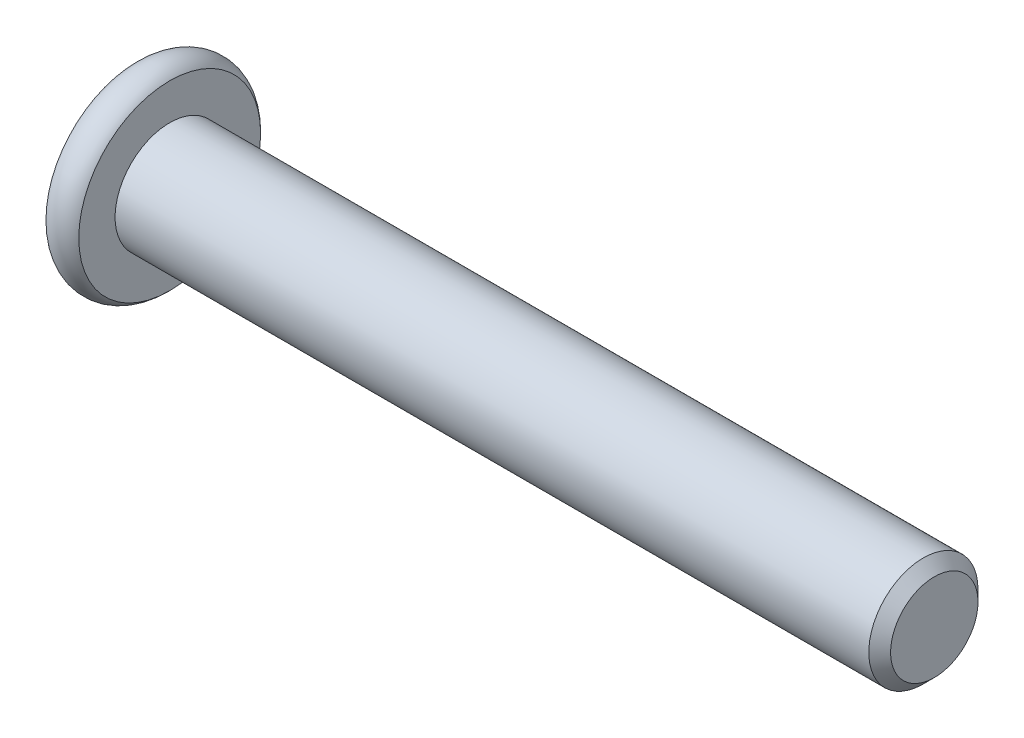
from build123d import *

# Parameters (mm, degrees)
SKETCH2_R           = 2.5
BOSS_EXTRUDE1_DEPTH = 35
CHAMFER1_SIZE       = 0.5
CUT_EXTRUDE1_DEPTH  = 2.3
SKETCH8_R           = 1.782050808
CUT_EXTRUDE2_DEPTH  = 1
CUT_EXTRUDE2_DRAFT  = -45


with BuildPart() as part:
    # Sketch2 → Boss-Extrude1 (new body)
    with BuildSketch(Plane(origin=(0, 0, 0), x_dir=(0, 0, -1), z_dir=(1, 0, 0))):
        Circle(SKETCH2_R)
    extrude(amount=-BOSS_EXTRUDE1_DEPTH)

    # Chamfer1
    chamfer1_edges = [part.edges().sort_by_distance(p)[0] for p in [
        (0, 0, 2.5),
    ]]
    chamfer(chamfer1_edges, length=CHAMFER1_SIZE)

    # Sketch6 → Revolve1 (revolve)
    with BuildSketch(Plane.XY, mode=Mode.PRIVATE) as revolve1_sk:
        with BuildLine():
            Line((-36.5, 0), (-36.5, 4.161437828))
            ThreePointArc((-36.5, 4.161437828), (-35.75, 4.5), (-35, 4.161437828))
            Line((-35, 4.161437828), (-35, 0))
            Line((-35, 0), (-36.5, 0))
        make_face()
    revolve(revolve1_sk.sketch.rotate(Axis((-35, 0, 0), (1, 0, 0)), 180), axis=Axis((-35, 0, 0), (1, 0, 0)))

    # Sketch7 → Cut-Extrude1 (cut)
    with BuildSketch(Plane.ZY.offset(36.5)):
        Polygon((0, 1.732050808), (-1.5, 0.866025404), (-1.5, -0.866025404), (0, -1.732050808), (1.5, -0.866025404), (1.5, 0.866025404), align=None)
    extrude(amount=-CUT_EXTRUDE1_DEPTH, mode=Mode.SUBTRACT)


with BuildPart() as cut_extrude2_tool:
    # Sketch8 → Cut-Extrude2 (with draft: the straight prism first)
    with BuildSketch(Plane.ZY.offset(36.5)):
        Circle(SKETCH8_R)
    extrude(amount=-CUT_EXTRUDE2_DEPTH)
    # Cut-Extrude2: the draft: its side faces are tilted about the plane it starts from
    cut_extrude2_sides = [cut_extrude2_tool.faces().sort_by_distance(p)[0] for p in [
        (-36, 0, -1.782050808),
    ]]
    draft(cut_extrude2_sides, Plane.ZY.offset(36.5), CUT_EXTRUDE2_DRAFT)


with BuildPart() as part_1:
    add(part.part)

    # Cut-Extrude2: cut by cut_extrude2_tool
    add(cut_extrude2_tool.part, mode=Mode.SUBTRACT)


solid = part_1.part
